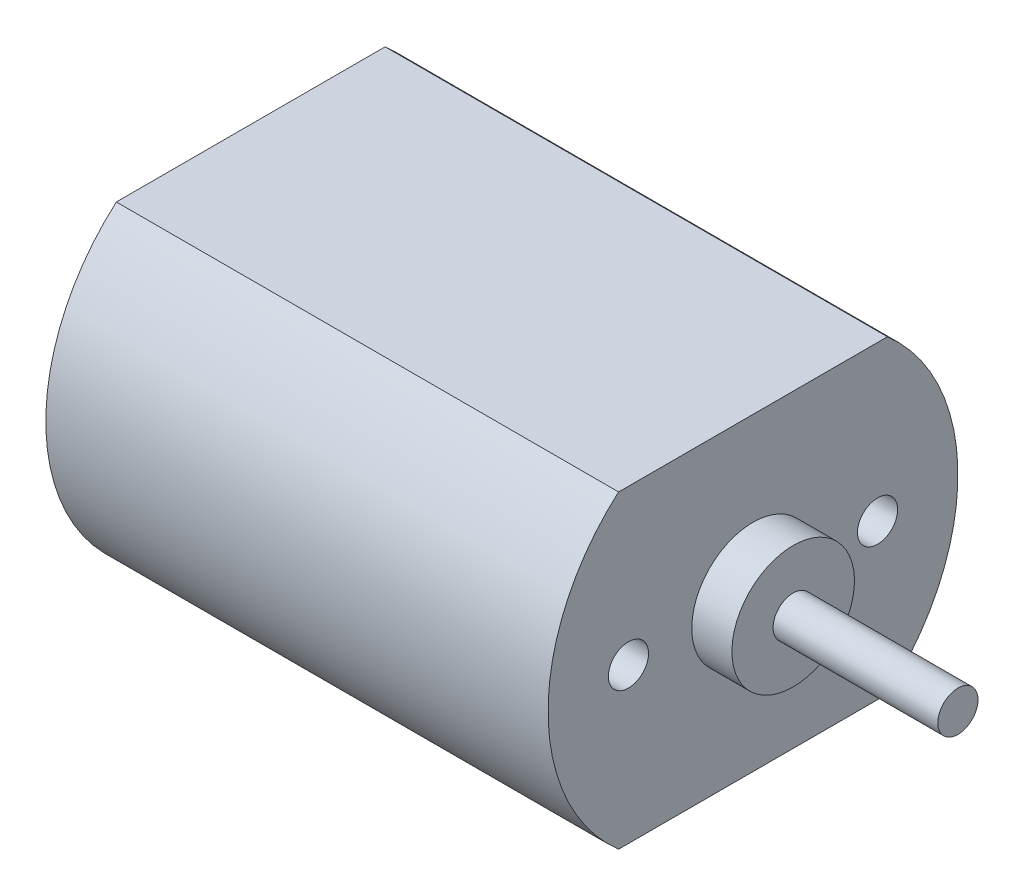
from build123d import *

# Parameters (mm, degrees)
CUT_EXTRUDE_START   = -36
CUT_EXTRUDE_1_DEPTH = 36
SKETCH_3_R          = 1
CUT_EXTRUDE_2_DEPTH = 8
CUT_EXTRUDE_4_DEPTH = 0.6


with BuildPart() as part:
    # 草图1 → 旋转3 (revolve)
    with BuildSketch(Plane.XY):
        Polygon((25, 7.15), (25, 0), (0, 0), (0, 7.15), (-1.6, 7.15), (-1.6, 10.2), (35.2, 10.2), (35.2, 9.2), (27, 9.2), (27, 7.15), align=None)
    revolve(axis=Axis((-1.6, 10.2, 0), (1, 0, 0)))

    # 草图2 → 切除-拉伸1 (cut)
    with BuildSketch(Plane(origin=(25, 0, 0), x_dir=(0, 0, -1), z_dir=(1, 0, 0)).offset(CUT_EXTRUDE_START)):
        with BuildLine():
            Line((-6.68954408, 17.9), (6.68954408, 17.9))
            ThreePointArc((6.68954408, 17.9), (0, 20.4), (-6.68954408, 17.9))
        make_face()
        with BuildLine():
            Line((-6.68954408, 2.5), (6.68954408, 2.5))
            ThreePointArc((6.68954408, 2.5), (0, 0), (-6.68954408, 2.5))
        make_face()
    extrude(amount=CUT_EXTRUDE_1_DEPTH, mode=Mode.SUBTRACT)

    # 草图3 → 切除-拉伸2 (cut)
    with BuildSketch(Plane(origin=(25, 0, 0), x_dir=(0, 0, -1), z_dir=(1, 0, 0))):
        with Locations(Location((-6.2, 10.2, 0), (0, 0, 90))):
            Circle(SKETCH_3_R)
        with Locations(Location((6.2, 10.2, 0), (0, 0, 270))):
            Circle(SKETCH_3_R)
    extrude(amount=-CUT_EXTRUDE_2_DEPTH, mode=Mode.SUBTRACT)

    # 草图4 → 切除-拉伸4 (cut)
    with BuildSketch(Plane.ZY):
        with BuildLine():
            Line((6.5, 3), (-6.5, 3))
            ThreePointArc((-6.5, 3), (-9.7, 10.2), (-6.5, 17.4))
            Line((-6.5, 17.4), (6.5, 17.4))
            ThreePointArc((6.5, 17.4), (9.7, 10.2), (6.5, 3))
        make_face()
    extrude(amount=-CUT_EXTRUDE_4_DEPTH, mode=Mode.SUBTRACT)


with BuildPart() as cut_extrude_4_piece_1:
    # of the separate pieces the step leaves, piece 1, a body of its own (cut_extrude_4_pieces)
    add(part.part.solids().sort_by_distance((25, 2.5, -6.68954408))[0])


with BuildPart() as cut_extrude_4_piece_2:
    # of the separate pieces the step leaves, piece 2, a body of its own (cut_extrude_4_pieces)
    add(part.part.solids().sort_by_distance((0, 7.15, 0))[0])


solid = Compound([cut_extrude_4_piece_1.part, cut_extrude_4_piece_2.part])
